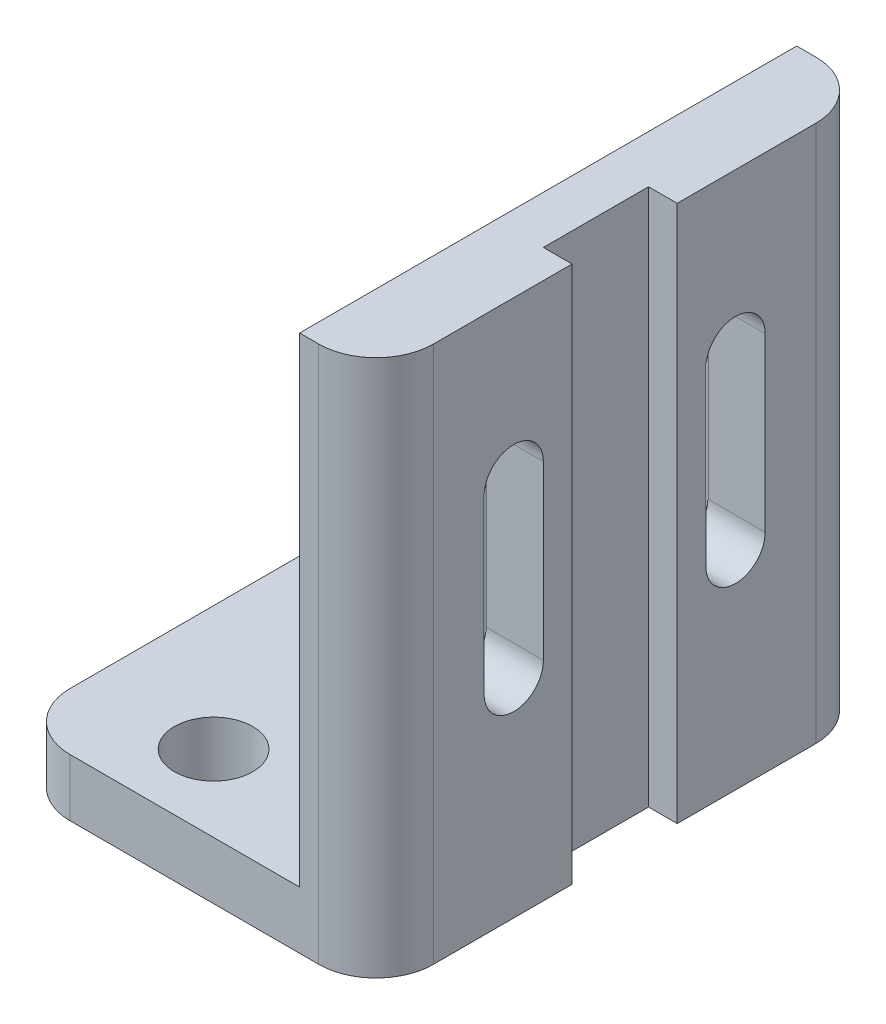
from build123d import *

# Parameters (mm, degrees)
BOSS_EXTRUDE1_DEPTH                       = 26
BLTOUCHPROBEMOUNTHOLESSKETCH2_R           = 2.05
BLTOUCHPROBEMOUNTHOLESCUT_EXTRUDE1_DEPTH  = 41.829033787
FILLET1_R                                 = 3
PROBESLIDINGMOUNTCUT_EXTRUDE3_DEPTH       = 42.117028103
PROBESLIDINGMOUNTCHANELCUT_EXTRUDE4_DEPTH = 1
CABLECHANNELSKETCH1_W                     = 5.5
CABLECHANNELSKETCH1_H                     = 28.1
CABLECUT_EXTRUDE1_DEPTH                   = 1.5


with BuildPart() as part:
    # ProfileSketch1 → Boss-Extrude1 (new body)
    with BuildSketch(Plane.XY):
        Polygon((0, 0), (19, 0), (19, 28.1), (15, 28.1), (15, 3), (0, 3), align=None)
    extrude(amount=BOSS_EXTRUDE1_DEPTH)

    # BLTouchProbeMountHolesSketch2 → BLTouchProbeMountHolesCut-Extrude1 (cut, through all)
    with BuildSketch(Plane(origin=(0, 3, 0), x_dir=(1, 0, 0), z_dir=(0, 1, 0))):
        with Locations(Location((6.5, -4, 0), (0, 0, 180))):
            Circle(BLTOUCHPROBEMOUNTHOLESSKETCH2_R)
        with Locations(Location((6.5, -22, 0), (0, 0, 180))):
            Circle(BLTOUCHPROBEMOUNTHOLESSKETCH2_R)
    extrude(amount=-BLTOUCHPROBEMOUNTHOLESCUT_EXTRUDE1_DEPTH, mode=Mode.SUBTRACT)

    # Fillet1
    fillet1_edges = [part.edges().sort_by_distance(p)[0] for p in [
        (19, 14.05, 26),
        (0, 1.5, 26),
        (19, 14.05, 0),
        (0, 1.5, 0),
    ]]
    fillet(fillet1_edges, radius=FILLET1_R)

    # ProbeSlidingMountSketch4 → ProbeSlidingMountCut-Extrude3 (cut, through all)
    with BuildSketch(Plane.ZY.offset(-15)):
        with BuildLine():
            Line((5.65, 19.9), (5.65, 10.9))
            ThreePointArc((5.65, 10.9), (7.2, 9.35), (8.75, 10.9))
            Line((8.75, 10.9), (8.75, 19.9))
            ThreePointArc((8.75, 19.9), (7.2, 21.45), (5.65, 19.9))
        make_face()
        with BuildLine():
            Line((17.25, 19.9), (17.25, 10.9))
            ThreePointArc((17.25, 10.9), (18.8, 9.35), (20.35, 10.9))
            Line((20.35, 10.9), (20.35, 19.9))
            ThreePointArc((20.35, 19.9), (18.8, 21.45), (17.25, 19.9))
        make_face()
    extrude(amount=-PROBESLIDINGMOUNTCUT_EXTRUDE3_DEPTH, mode=Mode.SUBTRACT)

    # ProbeSlidingMountChannelSketch5 → ProbeSlidingMountChanelCut-Extrude4 (cut)
    with BuildSketch(Plane.ZY.offset(-15)):
        with BuildLine():
            Line((10.4, 19.9), (10.4, 10.9))
            ThreePointArc((10.4, 10.9), (7.2, 7.7), (4, 10.9))
            Line((4, 10.9), (4, 19.9))
            ThreePointArc((4, 19.9), (7.2, 23.1), (10.4, 19.9))
        make_face()
        with BuildLine():
            Line((22, 19.9), (22, 10.9))
            ThreePointArc((22, 10.9), (18.8, 7.7), (15.6, 10.9))
            Line((15.6, 10.9), (15.6, 19.9))
            ThreePointArc((15.6, 19.9), (18.8, 23.1), (22, 19.9))
        make_face()
    extrude(amount=-PROBESLIDINGMOUNTCHANELCUT_EXTRUDE4_DEPTH, mode=Mode.SUBTRACT)

    # CableChannelSketch1 → CableCut-Extrude1 (cut)
    with BuildSketch(Plane(origin=(19, 0, 0), x_dir=(0, 0, -1), z_dir=(1, 0, 0))):
        with Locations((-13, 14.05)):
            Rectangle(CABLECHANNELSKETCH1_W, CABLECHANNELSKETCH1_H)
    extrude(amount=-CABLECUT_EXTRUDE1_DEPTH, mode=Mode.SUBTRACT)


solid = part.part
